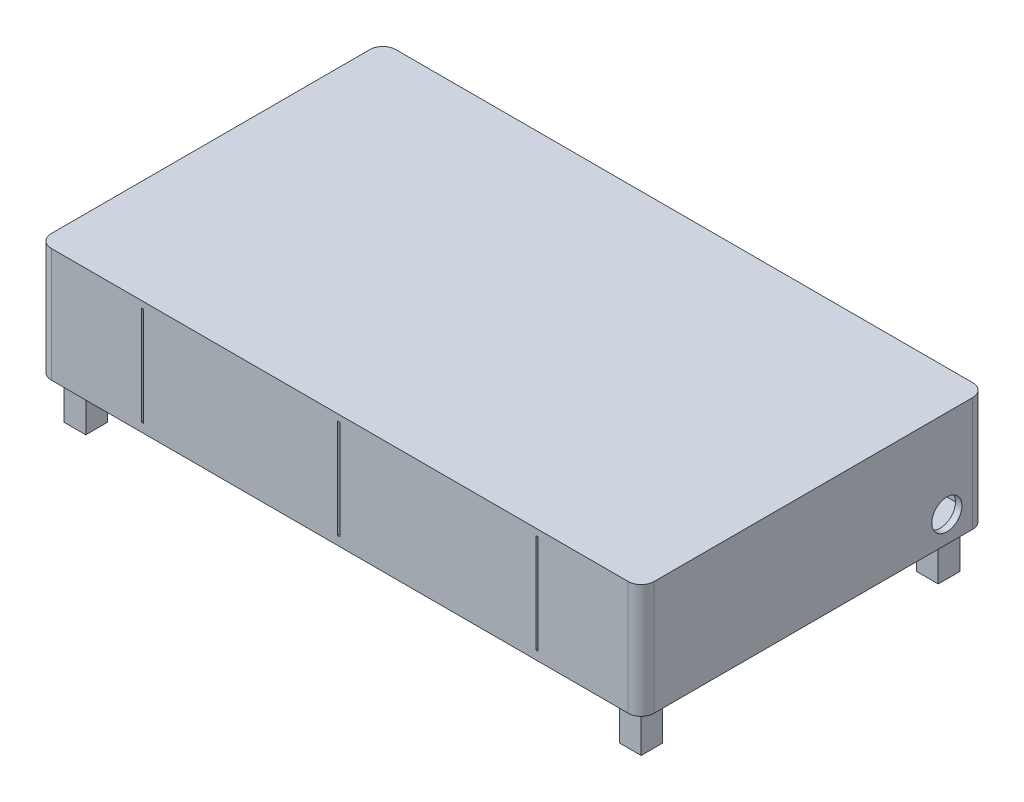
from build123d import *

# Parameters (mm, degrees)
SKETCH1_W           = 140
SKETCH1_H           = 80
BOSS_EXTRUDE1_DEPTH = 2
SKETCH2_W           = 45.094685242
SKETCH2_H           = 1.5
SKETCH2_W_2         = 45.594685242
BOSS_EXTRUDE3_DEPTH = 23
SKETCH3_W           = 140
SKETCH3_H           = 80
BOSS_EXTRUDE4_DEPTH = 1.5
SKETCH4_R           = 3.5
CUT_EXTRUDE1_DEPTH  = 5
FILLET1_R           = 3
SKETCH5_W           = 5
SKETCH5_H           = 5
BOSS_EXTRUDE5_DEPTH = 10


with BuildPart() as part:
    # Sketch1 → Boss-Extrude1 (new body)
    with BuildSketch(Plane(origin=(0, 0, 0), x_dir=(1, 0, 0), z_dir=(0, 1, 0))):
        Rectangle(SKETCH1_W, SKETCH1_H)
        Polygon((68.5, -18), (68.5, 17), (30, 17), (30, 38.5), (-58.5, 38.5), (-58.5, 28.5), (-68.5, 28.5), (-68.5, -28.5), (-58.5, -28.5), (-58.5, -38.5), (-40, -38.5), (-40, -18), align=None, mode=Mode.SUBTRACT)
    extrude(amount=BOSS_EXTRUDE1_DEPTH)

    # Sketch2 → Boss-Extrude3 (add)
    with BuildSketch(Plane(origin=(0, 2, 0), x_dir=(1, 0, 0), z_dir=(0, 1, 0))):
        with Locations((-23.047342621, 39.25)):
            Rectangle(SKETCH2_W, SKETCH2_H)
        with Locations((-23.047342621, -39.25)):
            Rectangle(SKETCH2_W, SKETCH2_H)
        Polygon((-46.094685242, 40), (-46.094685242, 38.5), (-68.5, 38.5), (-68.5, -38.5), (-46.094685242, -38.5), (-46.094685242, -40), (-70, -40), (-70, 40), align=None)
        with Locations((22.797342621, -39.25)):
            Rectangle(SKETCH2_W_2, SKETCH2_H)
        Polygon((46.094685242, -38.5), (46.094685242, -40), (70, -40), (70, 40), (46.094685242, 40), (46.094685242, 38.5), (68.5, 38.5), (68.5, -38.5), align=None)
        with Locations((22.797342621, 39.25)):
            Rectangle(SKETCH2_W_2, SKETCH2_H)
    extrude(amount=BOSS_EXTRUDE3_DEPTH)

    # Sketch3 → Boss-Extrude4 (add)
    with BuildSketch(Plane(origin=(0, 25, 0), x_dir=(1, 0, 0), z_dir=(0, 1, 0))):
        Rectangle(SKETCH3_W, SKETCH3_H)
    extrude(amount=BOSS_EXTRUDE4_DEPTH)

    # Sketch4 → Cut-Extrude1 (cut)
    with BuildSketch(Plane(origin=(70, 0, 0), x_dir=(0, 0, -1), z_dir=(1, 0, 0))):
        with Locations((31, 6)):
            Circle(SKETCH4_R)
    extrude(amount=-CUT_EXTRUDE1_DEPTH, mode=Mode.SUBTRACT)

    # Fillet1
    fillet1_edges = [part.edges().sort_by_distance(p)[0] for p in [
        (70, 13.25, 40),
        (-70, 13.25, 40),
        (-70, 13.25, -40),
        (70, 13.25, -40),
        (-68.5, 13.5, 38.5),
        (-68.5, 13.5, -38.5),
    ]]
    fillet(fillet1_edges, radius=FILLET1_R)

    # Sketch5 → Boss-Extrude5 (add)
    with BuildSketch(Plane.XZ):
        with Locations((-64.5, 34.5)):
            Rectangle(SKETCH5_W, SKETCH5_H)
        with Locations((64.5, 34.5)):
            Rectangle(SKETCH5_W, SKETCH5_H)
        with Locations((64.5, -34.5)):
            Rectangle(SKETCH5_W, SKETCH5_H)
        with Locations((-64.5, -34.5)):
            Rectangle(SKETCH5_W, SKETCH5_H)
    extrude(amount=BOSS_EXTRUDE5_DEPTH)


solid = part.part
